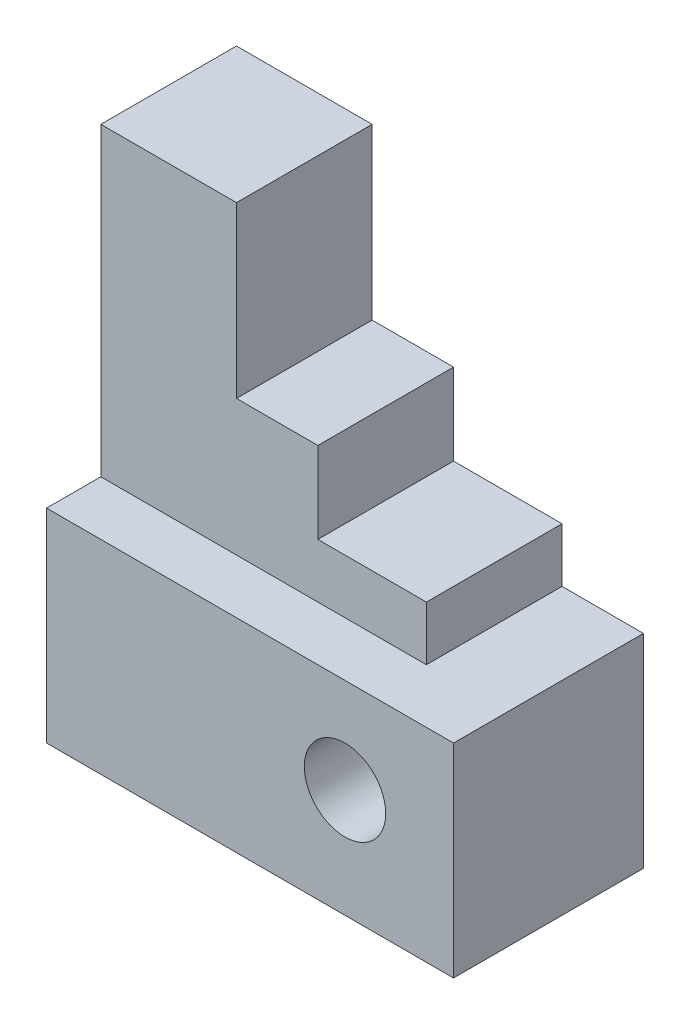
from build123d import *

# Parameters (mm, degrees)
SKETCH8_R           = 6
BOSS_EXTRUDE5_DEPTH = 28
BOSS_EXTRUDE6_DEPTH = 20


with BuildPart() as part:
    # Sketch8 → Boss-Extrude5 (new body)
    with BuildSketch(Plane.XY):
        Polygon((0, 30), (0, 0), (60, 0), (60, 30), (48, 30), align=None)
        with Locations((44, 16)):
            Circle(SKETCH8_R, mode=Mode.SUBTRACT)
    extrude(amount=BOSS_EXTRUDE5_DEPTH)

    # Sketch8<3> → Boss-Extrude6 (add)
    with BuildSketch(Plane.XY):
        Polygon((0, 75), (0, 30), (48, 30), (48, 38), (32, 38), (32, 50), (20, 50), (20, 75), align=None)
    extrude(amount=BOSS_EXTRUDE6_DEPTH)


solid = part.part
